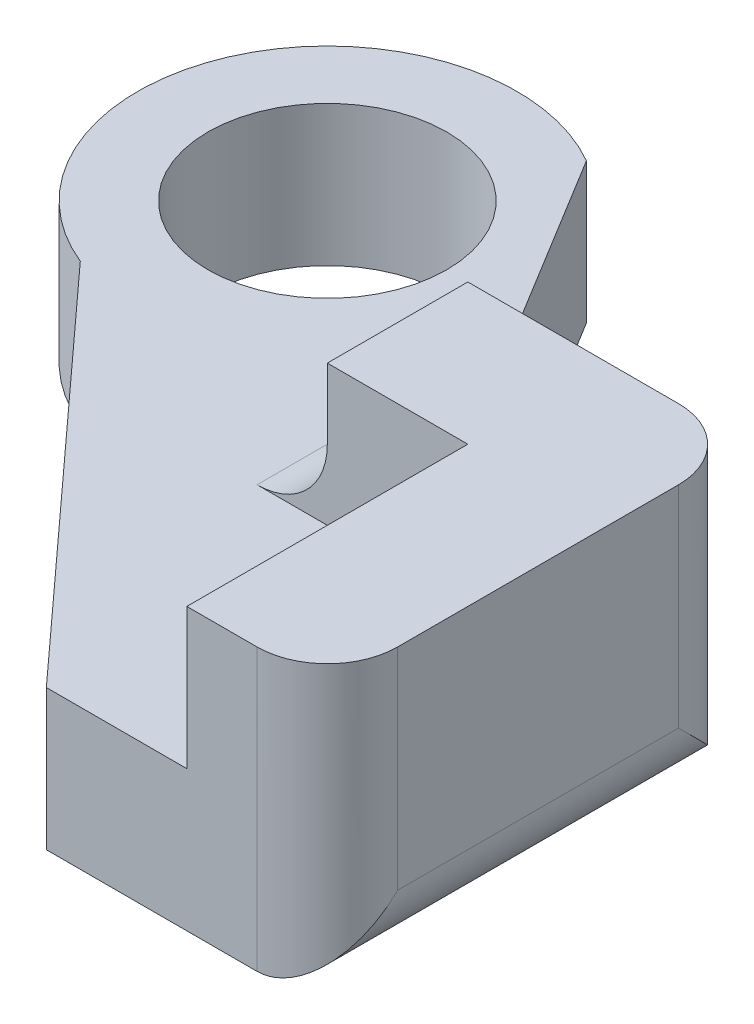
from build123d import *

# Parameters (mm, degrees)
SKETCH1_W           = 20
SKETCH1_H           = 30
BOSS_EXTRUDE1_DEPTH = 10
BOSS_EXTRUDE2_DEPTH = 10
SKETCH4_R           = 8.5
BOSS_EXTRUDE3_DEPTH = 10
FILLET1_R           = 5


with BuildPart() as part:
    # Sketch1 → Boss-Extrude1 (new body)
    with BuildSketch(Plane(origin=(0, 0, 0), x_dir=(1, 0, 0), z_dir=(0, 1, 0))):
        with Locations((10, -15)):
            Rectangle(SKETCH1_W, SKETCH1_H)
    extrude(amount=BOSS_EXTRUDE1_DEPTH)

    # Sketch2 → Boss-Extrude2 (add)
    with BuildSketch(Plane(origin=(0, 10, 0), x_dir=(1, 0, 0), z_dir=(0, 1, 0))):
        Polygon((0, 0), (0, -10), (10, -10), (10, -30), (20, -30), (20, 0), align=None)
    extrude(amount=BOSS_EXTRUDE2_DEPTH)

    # Sketch4 → Boss-Extrude3 (add)
    with BuildSketch(Plane(origin=(0, 10, 0), x_dir=(1, 0, 0), z_dir=(0, 1, 0))):
        with BuildLine():
            Line((0, 0), (-13.247067503, 21.689649383))
            ThreePointArc((-13.247067503, 21.689649383), (-32.129444614, 15.92676753), (-25.072116083, -2.510940749))
            Line((-25.072116083, -2.510940749), (0, -30))
            Line((0, -30), (0, 0))
        make_face()
        with Locations(Location((-20, 10, 0), (0, 0, 270))):
            Circle(SKETCH4_R, mode=Mode.SUBTRACT)
    extrude(amount=-BOSS_EXTRUDE3_DEPTH)

    # Fillet1
    fillet1_edges = [part.edges().sort_by_distance(p)[0] for p in [
        (0, 10, 5),
        (20, 0, 15),
        (20, 10, 0),
        (20, 10, 30),
    ]]
    fillet(fillet1_edges, radius=FILLET1_R)


solid = part.part
